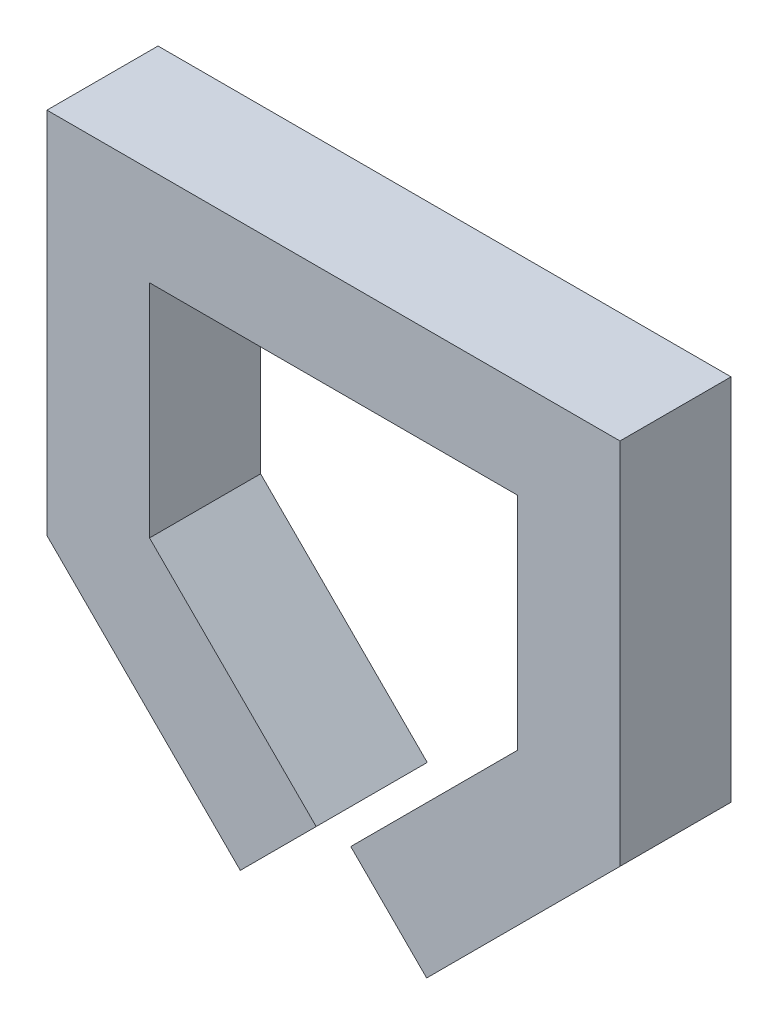
from build123d import *

# Parameters (mm, degrees)
BOSS_EXTRUDE1_DEPTH = 20


with BuildPart() as part:
    # Sketch2 → Boss-Extrude1 (new body)
    with BuildSketch(Plane.XY):
        Polygon((121.262122634, -54.94533424), (86.447807088, -20.131018695), (86.447807088, 46.215709925), (189.639314868, 46.215709925), (189.639314868, -20.131018695), (154.824999322, -54.94533424), (141.156959102, -41.277294021), (171.166129255, -11.268123868), (171.166129255, 28.52985593), (104.920992701, 28.52985593), (104.920992701, -11.268123868), (134.930162854, -41.277294021), align=None)
    extrude(amount=BOSS_EXTRUDE1_DEPTH)


solid = part.part
